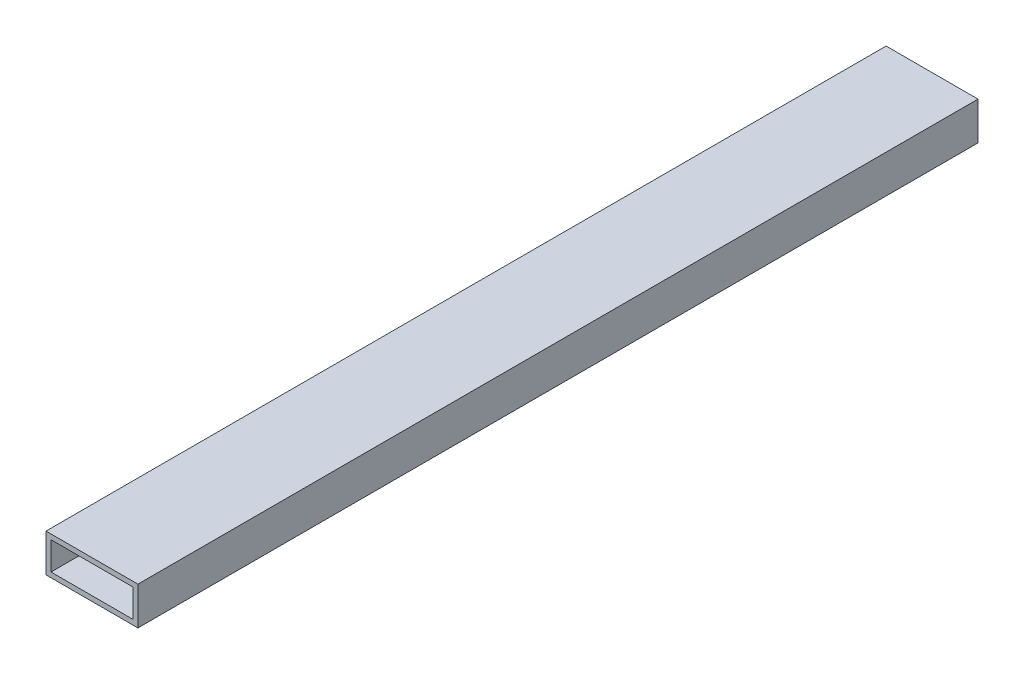
from build123d import *

# Parameters (mm, degrees)
MASTER_SKETCH_WING_GEOMETRY_MASTER_SKETC_W   = 92
MASTER_SKETCH_WING_GEOMETRY_MASTER_SKETC_H   = 38
MASTER_SKETCH_WING_GEOMETRY_MASTER_SKETC_W_2 = 82
MASTER_SKETCH_WING_GEOMETRY_MASTER_SKETC_H_2 = 28
BOSS_EXTRUDE2_DEPTH                          = 841


with BuildPart() as part:
    # Master sketch-Wing Geometry Master Sketc → Boss-Extrude2 (new body)
    with BuildSketch(Plane.XY):
        with Locations((90.000000001, 9.799999997)):
            Rectangle(MASTER_SKETCH_WING_GEOMETRY_MASTER_SKETC_W, MASTER_SKETCH_WING_GEOMETRY_MASTER_SKETC_H)
        with Locations((90.000000001, 9.799999997)):
            Rectangle(MASTER_SKETCH_WING_GEOMETRY_MASTER_SKETC_W_2, MASTER_SKETCH_WING_GEOMETRY_MASTER_SKETC_H_2, mode=Mode.SUBTRACT)
    extrude(amount=BOSS_EXTRUDE2_DEPTH)


solid = part.part
